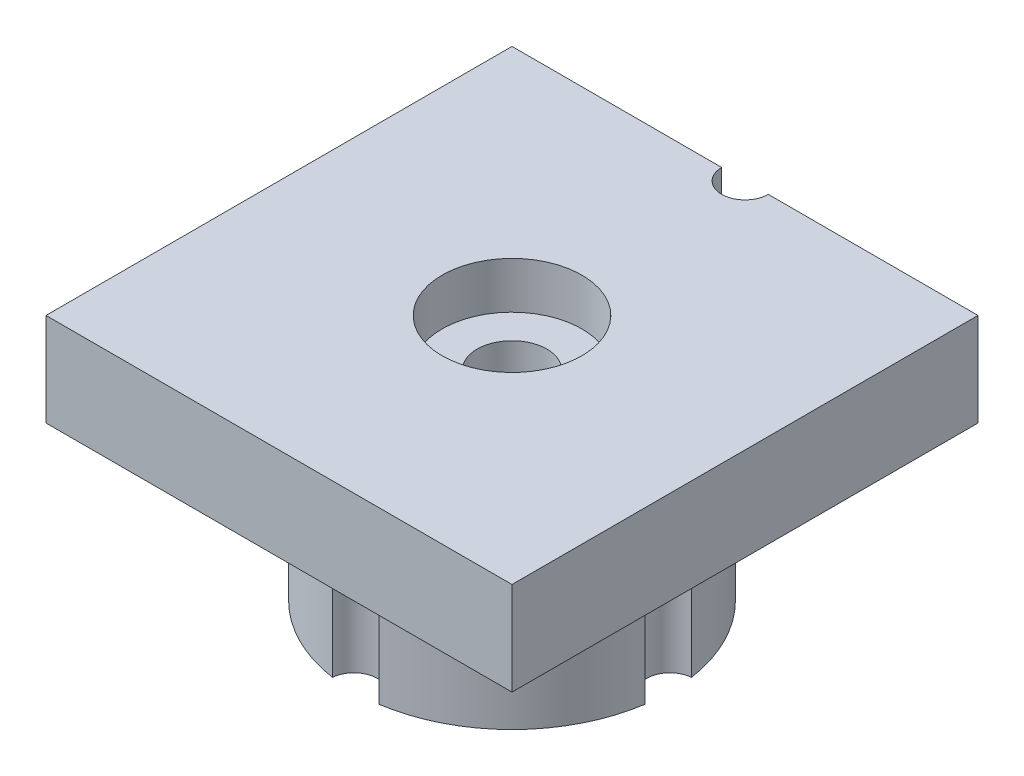
from build123d import *

# Parameters (mm, degrees)
SKETCH_1_W          = 10
SKETCH_1_H          = 10
EXTRUDE_1_DEPTH     = 2
EXTRUDE_2_DEPTH     = 3.3
SKETCH_3_R          = 2
CUT_EXTRUDE_1_DEPTH = 3.3
SKETCH_4_R          = 0.75
CUT_EXTRUDE_2_DEPTH = 3.3
SKETCH_5_R          = 1.5
CUT_EXTRUDE_3_DEPTH = 1
CUT_EXTRUDE_4_DEPTH = 9.836854644


with BuildPart() as part:
    # 草图1 → 凸台-拉伸1 (new body)
    with BuildSketch(Plane(origin=(0, 0, 0), x_dir=(1, 0, 0), z_dir=(0, 1, 0))):
        Rectangle(SKETCH_1_W, SKETCH_1_H)
    extrude(amount=EXTRUDE_1_DEPTH)

    # 草图2 → 凸台-拉伸2 (add)
    with BuildSketch(Plane.XZ):
        with BuildLine():
            ThreePointArc((-3.353126844, -0.498638517), (-2.397091988, -2.397091988), (-0.498638517, -3.353126844))
            ThreePointArc((-0.498638517, -3.353126844), (0, -2.89), (0.498638517, -3.353126844))
            ThreePointArc((0.498638517, -3.353126844), (2.397091988, -2.397091988), (3.353126844, -0.498638517))
            ThreePointArc((3.353126844, -0.498638517), (2.89, 0), (3.353126844, 0.498638517))
            ThreePointArc((3.353126844, 0.498638517), (2.397091988, 2.397091988), (0.498638517, 3.353126844))
            ThreePointArc((0.498638517, 3.353126844), (0, 2.89), (-0.498638517, 3.353126844))
            ThreePointArc((-0.498638517, 3.353126844), (-2.397091988, 2.397091988), (-3.353126844, 0.498638517))
            ThreePointArc((-3.353126844, 0.498638517), (-2.89, 0), (-3.353126844, -0.498638517))
        make_face()
    extrude(amount=EXTRUDE_2_DEPTH)

    # 草图3 → 切除-拉伸1 (cut)
    with BuildSketch(Plane.XZ.offset(3.3)):
        with Locations(Location((0, 0, 0), (0, 0, 270))):
            Circle(SKETCH_3_R)
    extrude(amount=-CUT_EXTRUDE_1_DEPTH, mode=Mode.SUBTRACT)

    # 草图4 → 切除-拉伸2 (cut)
    with BuildSketch(Plane.XZ):
        with Locations(Location((0, 0, 0), (0, 0, 270))):
            Circle(SKETCH_4_R)
    extrude(amount=-CUT_EXTRUDE_2_DEPTH, mode=Mode.SUBTRACT)

    # 草图5 → 切除-拉伸3 (cut)
    with BuildSketch(Plane(origin=(0, 2, 0), x_dir=(1, 0, 0), z_dir=(0, 1, 0))):
        with Locations(Location((0, 0, 0), (0, 0, 270))):
            Circle(SKETCH_5_R)
    extrude(amount=-CUT_EXTRUDE_3_DEPTH, mode=Mode.SUBTRACT)

    # 草图6 → 切除-拉伸4 (cut, through all)
    with BuildSketch(Plane(origin=(0, 2, 0), x_dir=(1, 0, 0), z_dir=(0, 1, 0))):
        with BuildLine():
            Line((-0.5, 5), (0.5, 5))
            ThreePointArc((0.5, 5), (0, 4.5), (-0.5, 5))
        make_face()
    extrude(amount=-CUT_EXTRUDE_4_DEPTH, mode=Mode.SUBTRACT)


solid = part.part
